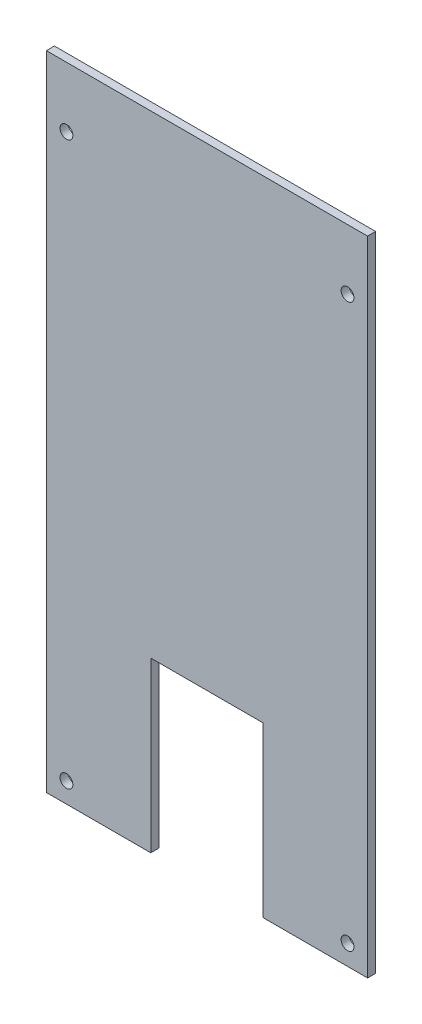
from build123d import *

# Parameters (mm, degrees)
BOSS_EXTRU_1_DEPTH      = 2
ESQUISSE2_R             = 1.6
ENL_V_MAT_EXTRU_1_DEPTH = 10


with BuildPart() as part:
    # Esquisse1 → Boss.-Extru.1 (new body)
    with BuildSketch(Plane.XY):
        Polygon((80, 160), (40, 160), (40, 42), (54, 42), (54, 0), (80, 0), align=None)
        Polygon((40, 42), (40, 160), (0, 160), (0, 0), (26, 0), (26, 42), align=None)
    extrude(amount=BOSS_EXTRU_1_DEPTH)

    # Esquisse2 → Enlèv. mat.-Extru.1 (cut)
    with BuildSketch(Plane.XY):
        with Locations((5, 145)):
            Circle(ESQUISSE2_R)
        with Locations((5, 5)):
            Circle(ESQUISSE2_R)
        with Locations(Location((75, 5, 0), (0, 0, 180))):
            Circle(ESQUISSE2_R)
        with Locations(Location((75, 145, 0), (0, 0, 180))):
            Circle(ESQUISSE2_R)
    extrude(amount=ENL_V_MAT_EXTRU_1_DEPTH, mode=Mode.SUBTRACT)


solid = part.part
